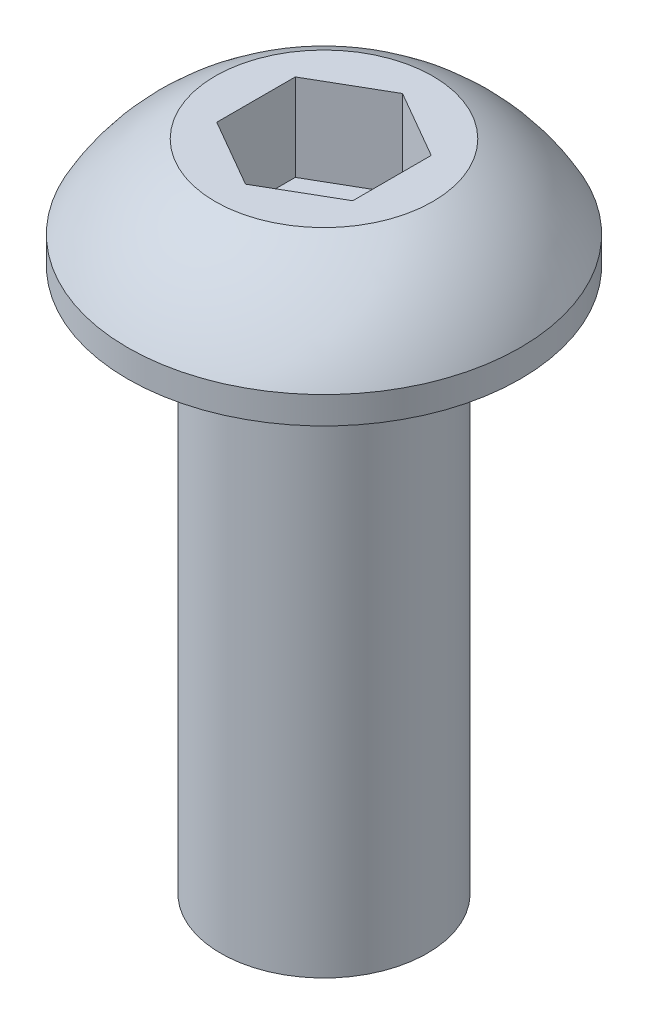
from build123d import *

# Parameters (mm, degrees)
CUT_EXTRUDE1_DEPTH = 2.032
SKETCH3_R          = 2.413
EXTRUDE1_DEPTH     = 12.7


with BuildPart() as part:
    # Sketch1 → Revolve1 (revolve)
    with BuildSketch(Plane.XY, mode=Mode.PRIVATE) as revolve1_sk:
        with BuildLine():
            Line((4.5847, 0), (4.5847, 0.635))
            ThreePointArc((4.5847, 0.635), (3.714445355, 1.761301001), (2.54, 2.5654))
            Line((2.54, 2.5654), (0, 2.5654))
            Line((0, 2.5654), (0, 0))
            Line((0, 0), (4.5847, 0))
        make_face()
    revolve(revolve1_sk.sketch.rotate(Axis((0, 0, 0), (0, 1, 0)), 90), axis=Axis((0, 0, 0), (0, 1, 0)))

    # Sketch2 → Cut-Extrude1 (cut)
    with BuildSketch(Plane(origin=(0, 2.5654, 0), x_dir=(-1, 0, 0), z_dir=(0, 1, 0))):
        Polygon((0, 1.833087105), (-1.5875, 0.916543552), (-1.5875, -0.916543552), (0, -1.833087105), (1.5875, -0.916543552), (1.5875, 0.916543552), align=None)
    extrude(amount=-CUT_EXTRUDE1_DEPTH, mode=Mode.SUBTRACT)

    # Sketch3 → Extrude1 (add)
    with BuildSketch(Plane.XZ):
        with Locations(Location((0, 0, 0), (0, 0, 270))):
            Circle(SKETCH3_R)
    extrude(amount=EXTRUDE1_DEPTH)


solid = part.part
